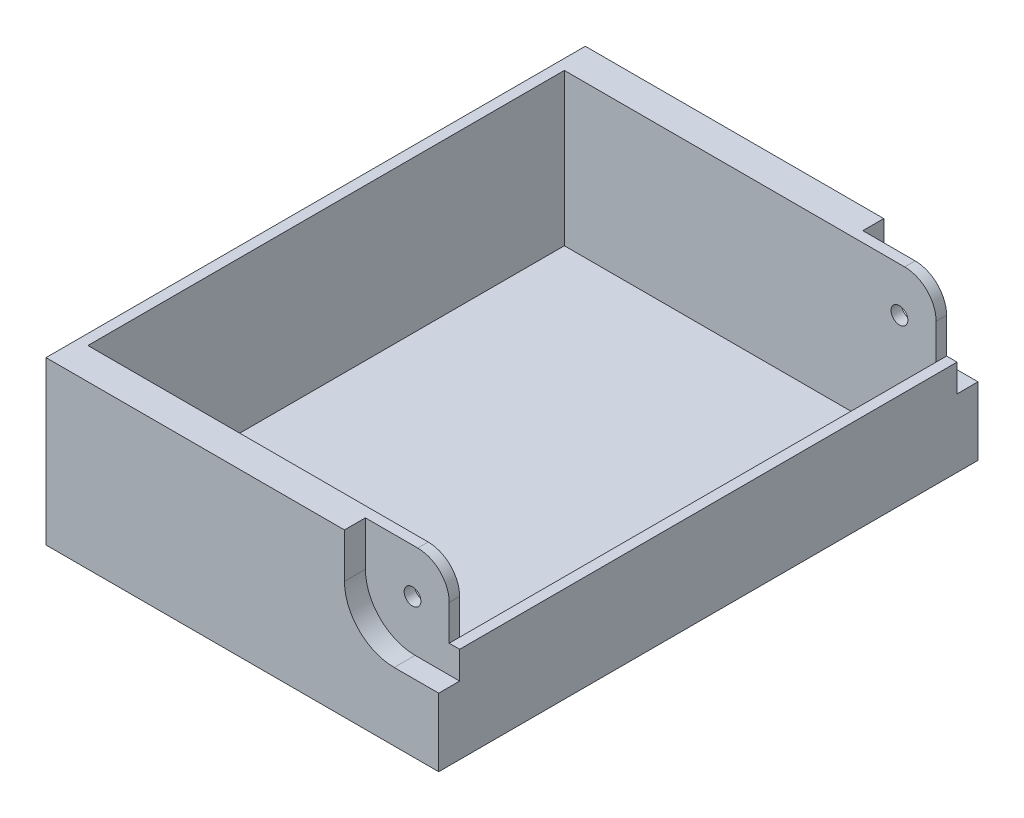
from build123d import *

# Parameters (mm, degrees)
SKETCH_1_W           = 75
SKETCH_1_H           = 95
EXTRUDE_1_DEPTH      = 25
SHELL_1_T            = -2
SKETCH_2_W           = 75
SKETCH_2_H           = 25
EXTRUDE_2_DEPTH      = 4
SKETCH_3_W           = 75
SKETCH_3_H           = 25
EXTRUDE_3_DEPTH      = 4
CUT_EXTRUDE_2_DEPTH  = 4
CUT_EXTRUDE_START    = -4
CUT_EXTRUDE_3_DEPTH  = 4
SKETCH_6_R           = 1.6
CUT_EXTRUDE_4_DEPTH  = 150
SKETCH_7_W           = 95
SKETCH_7_H           = 12.742640687
CUT_EXTRUDE_5_DEPTH  = 2
CUT_EXTRUDE_6_DEPTH  = 4
CUT_EXTRUDE_7_DEPTH  = 4
CUT_EXTRUDE_9_DEPTH  = 150
SKETCH_11_W          = 75
SKETCH_11_H          = 103
EXTRUDE_4_DEPTH      = 6
SKETCH_12_W          = 71
SKETCH_12_H          = 91
CUT_EXTRUDE_10_DEPTH = 6


with BuildPart() as part:
    # 草图1 → 凸台-拉伸1 (new body)
    with BuildSketch(Plane(origin=(0, 0, 0), x_dir=(1, 0, 0), z_dir=(0, 1, 0))):
        with Locations((-21.666666667, -5.700239808)):
            Rectangle(SKETCH_1_W, SKETCH_1_H)
    extrude(amount=EXTRUDE_1_DEPTH)

    # 抽壳1
    shell_1_openings = [part.faces().sort_by_distance(p)[0] for p in [
        (-21.666666667, 25, 5.700239808),
    ]]
    offset(amount=SHELL_1_T, openings=shell_1_openings, kind=Kind.INTERSECTION)

    # 草图2 → 凸台-拉伸2 (add)
    with BuildSketch(Plane.XY.offset(53.200239808)):
        with Locations((-21.666666667, 12.5)):
            Rectangle(SKETCH_2_W, SKETCH_2_H)
    extrude(amount=EXTRUDE_2_DEPTH)

    # 草图3 → 凸台-拉伸3 (add)
    with BuildSketch(Plane(origin=(0, 0, -41.799760192), x_dir=(-1, 0, 0), z_dir=(0, 0, -1))):
        with Locations((21.666666667, 12.5)):
            Rectangle(SKETCH_3_W, SKETCH_3_H)
    extrude(amount=EXTRUDE_3_DEPTH)

    # 草图4 → 切除-拉伸2 (cut)
    with BuildSketch(Plane(origin=(0, 0, -45.799760192), x_dir=(-1, 0, 0), z_dir=(0, 0, -1))):
        with BuildLine():
            Line((-16.833333333, 26), (-16.833333333, 16.5))
            ThreePointArc((-16.833333333, 16.5), (-7.333333333, 7), (2.166666667, 16.5))
            Line((2.166666667, 16.5), (2.166666667, 26))
            Line((2.166666667, 26), (-16.833333333, 26))
        make_face()
    extrude(amount=-CUT_EXTRUDE_2_DEPTH, mode=Mode.SUBTRACT)

    # 草图5 → 切除-拉伸3 (cut)
    with BuildSketch(Plane.XY.offset(57.200239808).offset(CUT_EXTRUDE_START)):
        with BuildLine():
            Line((-2.166666667, 26), (-2.166666667, 16.5))
            ThreePointArc((-2.166666667, 16.5), (7.333333333, 7), (16.833333333, 16.5))
            Line((16.833333333, 16.5), (16.833333333, 26))
            Line((16.833333333, 26), (-2.166666667, 26))
        make_face()
    extrude(amount=CUT_EXTRUDE_3_DEPTH, mode=Mode.SUBTRACT)

    # 草图6 → 切除-拉伸4 (cut)
    with BuildSketch(Plane.XY.offset(53.200239808)):
        with Locations((6.833333333, 16.5)):
            Circle(SKETCH_6_R)
    extrude(amount=-CUT_EXTRUDE_4_DEPTH, mode=Mode.SUBTRACT)

    # 草图7 → 切除-拉伸5 (cut)
    with BuildSketch(Plane(origin=(15.833333333, 0, 0), x_dir=(0, 0, -1), z_dir=(1, 0, 0))):
        with Locations((-5.700239808, 18.628679657)):
            Rectangle(SKETCH_7_W, SKETCH_7_H)
    extrude(amount=-CUT_EXTRUDE_5_DEPTH, mode=Mode.SUBTRACT)

    # 草图8 → 切除-拉伸6 (cut)
    with BuildSketch(Plane(origin=(0, 0, -45.799760192), x_dir=(-1, 0, 0), z_dir=(0, 0, -1))):
        Polygon((-7.333333333, 7), (-15.833333333, 7), (-15.833333333, 12.257359313), align=None)
    extrude(amount=-CUT_EXTRUDE_6_DEPTH, mode=Mode.SUBTRACT)

    # 草图9 → 切除-拉伸7 (cut)
    with BuildSketch(Plane.XY.offset(57.200239808)):
        Polygon((7.333333333, 7), (15.833333333, 7), (15.833333333, 12.257359313), align=None)
    extrude(amount=-CUT_EXTRUDE_7_DEPTH, mode=Mode.SUBTRACT)

    # 草图10 → 切除-拉伸9 (cut)
    with BuildSketch(Plane(origin=(0, 0, -41.799760192), x_dir=(-1, 0, 0), z_dir=(0, 0, -1))):
        with BuildLine():
            ThreePointArc((-13.833333333, 19), (-12.07597402, 23.242640687), (-7.833333333, 25))
            Line((-7.833333333, 25), (-13.833333333, 25))
            Line((-13.833333333, 25), (-13.833333333, 19))
        make_face()
    extrude(amount=-CUT_EXTRUDE_9_DEPTH, mode=Mode.SUBTRACT)

    # 草图11 → 凸台-拉伸4 (add)
    with BuildSketch(Plane.XZ):
        with Locations((-21.666666667, 5.700239808)):
            Rectangle(SKETCH_11_W, SKETCH_11_H)
    extrude(amount=EXTRUDE_4_DEPTH)

    # 草图12 → 切除-拉伸10 (cut)
    with BuildSketch(Plane(origin=(0, 2, 0), x_dir=(1, 0, 0), z_dir=(0, 1, 0))):
        with Locations((-21.666666667, -5.700239808)):
            Rectangle(SKETCH_12_W, SKETCH_12_H)
    extrude(amount=-CUT_EXTRUDE_10_DEPTH, mode=Mode.SUBTRACT)


solid = part.part
